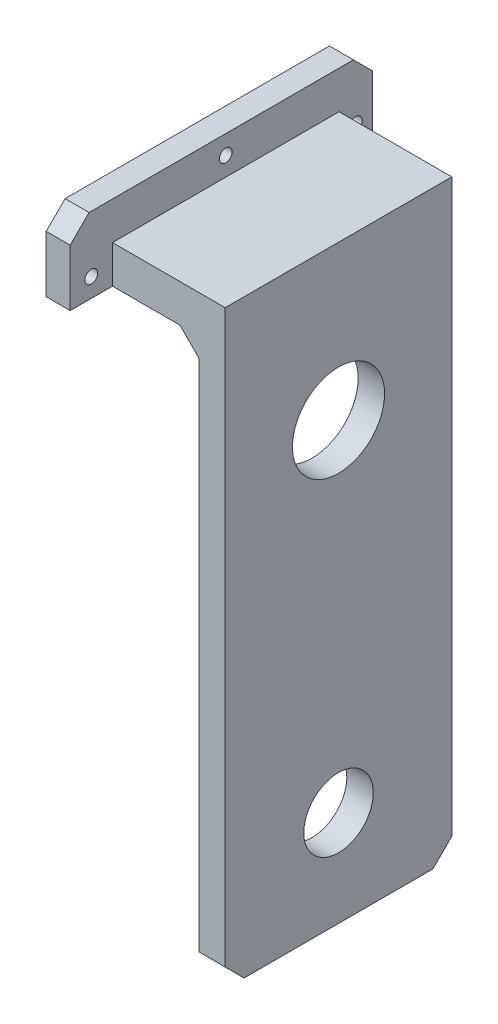
from build123d import *

# Parameters (mm, degrees)
SKETCH1_W           = 30
SKETCH1_H           = 5
BOSS_EXTRUDE1_DEPTH = 18.1
SKETCH2_W           = 40
SKETCH2_H           = 10
SKETCH2_R           = 0.85
BOSS_EXTRUDE2_DEPTH = 3.175
SKETCH3_W           = 3.5
SKETCH3_H           = 30
BOSS_EXTRUDE3_DEPTH = 73.1
CHAMFER1_SIZE       = 2.5
CHAMFER2_SIZE       = 2.5
CUT_EXTRUDE1_REACH  = 82.419
SKETCH4_R           = 6.1
SKETCH4_R_2         = 4.6
CHAMFER3_SIZE       = 2.5


with BuildPart() as part:
    # Sketch1 → Boss-Extrude1 (new body)
    with BuildSketch(Plane(origin=(0, 0, 0), x_dir=(0, 0, -1), z_dir=(1, 0, 0))):
        Rectangle(SKETCH1_W, SKETCH1_H)
    extrude(amount=BOSS_EXTRUDE1_DEPTH)

    # Sketch2 → Boss-Extrude2 (add)
    with BuildSketch(Plane.ZY):
        with Locations((0.597390222, 2.5)):
            Rectangle(SKETCH2_W, SKETCH2_H)
        with Locations((-17.201304889, 0)):
            Circle(SKETCH2_R, mode=Mode.SUBTRACT)
        with Locations((17.798695111, 0)):
            Circle(SKETCH2_R, mode=Mode.SUBTRACT)
        with Locations((0, 5)):
            Circle(SKETCH2_R, mode=Mode.SUBTRACT)
    extrude(amount=-BOSS_EXTRUDE2_DEPTH)

    # Sketch3 → Boss-Extrude3 (add)
    with BuildSketch(Plane.XZ.offset(2.5)):
        with Locations((16.35, 0)):
            Rectangle(SKETCH3_W, SKETCH3_H)
    extrude(amount=BOSS_EXTRUDE3_DEPTH)

    # Chamfer1
    chamfer1_edges = [part.edges().sort_by_distance(p)[0] for p in [
        (14.6, -2.5, 0),
    ]]
    chamfer(chamfer1_edges, length=CHAMFER1_SIZE)

    # Chamfer2
    chamfer2_edges = [part.edges().sort_by_distance(p)[0] for p in [
        (1.5875, 7.5, -19.402609778),
        (1.5875, 7.5, 20.597390222),
    ]]
    chamfer(chamfer2_edges, length=CHAMFER2_SIZE)

    # Sketch4 → Cut-Extrude1 (cut, up to next)
    with BuildSketch(Plane(origin=(18.1, 0, 0), x_dir=(0, 0, -1), z_dir=(1, 0, 0)), mode=Mode.PRIVATE) as cut_extrude1_sk1:
        with Locations((2.035e-06, -17.9)):
            Circle(SKETCH4_R)
    cut_extrude1_tool1 = extrude(cut_extrude1_sk1.sketch, amount=-CUT_EXTRUDE1_REACH, mode=Mode.PRIVATE) & part.part
    # Sketch4 → Cut-Extrude1 (cut, up to next)
    with BuildSketch(Plane(origin=(18.1, 0, 0), x_dir=(0, 0, -1), z_dir=(1, 0, 0)), mode=Mode.PRIVATE) as cut_extrude1_sk2:
        with Locations((5e-09, -62.9)):
            Circle(SKETCH4_R_2)
    cut_extrude1_tool2 = extrude(cut_extrude1_sk2.sketch, amount=-CUT_EXTRUDE1_REACH, mode=Mode.PRIVATE) & part.part
    add(cut_extrude1_tool1.solids().sort_by_distance((18.1, -17.9, -2e-06))[0], mode=Mode.SUBTRACT)
    add(cut_extrude1_tool2.solids().sort_by_distance((18.1, -62.9, 0))[0], mode=Mode.SUBTRACT)

    # Chamfer3
    chamfer3_edges = [part.edges().sort_by_distance(p)[0] for p in [
        (16.35, -75.6, 15),
        (16.35, -75.6, -15),
    ]]
    chamfer(chamfer3_edges, length=CHAMFER3_SIZE)


solid = part.part
